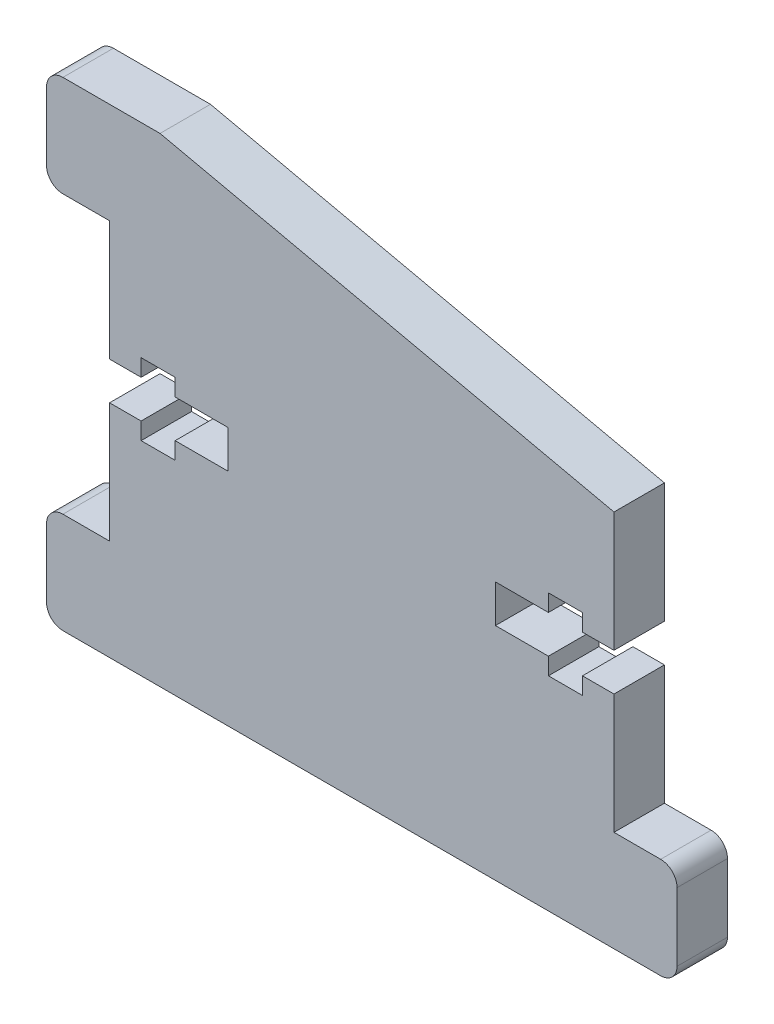
from build123d import *

# Parameters (mm, degrees)
EXTRUDE_1_DEPTH = 4
FILLET_1_R      = 1.3


with BuildPart() as part:
    # 草图1 → 凸台-拉伸1 (new body)
    with BuildSketch(Plane.XY):
        Polygon((-33.523824953, 29.589854129), (-28.523824953, 29.589854129), (11.476175047, 29.589854129), (16.476175047, 29.589854129), (16.476175047, 37.589854129), (11.476175047, 37.589854129), (11.476175047, 47.089854129), (8.976175047, 47.089854129), (8.976175047, 45.739854129), (6.276175047, 45.739854129), (6.276175047, 47.089854129), (2.076175047, 47.089854129), (2.076175047, 50.089854129), (6.276175047, 50.089854129), (6.276175047, 51.439854129), (8.976175047, 51.439854129), (8.976175047, 50.089854129), (11.476175047, 50.089854129), (11.476175047, 59.589854129), (-24.523824953, 67.589854129), (-28.523824953, 67.589854129), (-33.523824953, 67.589854129), (-33.523824953, 59.589854129), (-28.523824953, 59.589854129), (-28.523824953, 50.089854129), (-26.023824953, 50.089854129), (-26.023824953, 51.439854129), (-23.323824953, 51.439854129), (-23.323824953, 50.089854129), (-19.123824953, 50.089854129), (-19.123824953, 47.089854129), (-23.323824953, 47.089854129), (-23.323824953, 45.739854129), (-26.023824953, 45.739854129), (-26.023824953, 47.089854129), (-28.523824953, 47.089854129), (-28.523824953, 37.589854129), (-33.523824953, 37.589854129), align=None)
    extrude(amount=EXTRUDE_1_DEPTH)

    # 圆角1
    fillet_1_edges = [part.edges().sort_by_distance(p)[0] for p in [
        (-33.523824953, 59.589854129, 2),
        (-33.523824953, 67.589854129, 2),
        (16.476175047, 37.589854129, 2),
        (16.476175047, 29.589854129, 2),
        (-33.523824953, 29.589854129, 2),
        (-33.523824953, 37.589854129, 2),
    ]]
    fillet(fillet_1_edges, radius=FILLET_1_R)


solid = part.part
